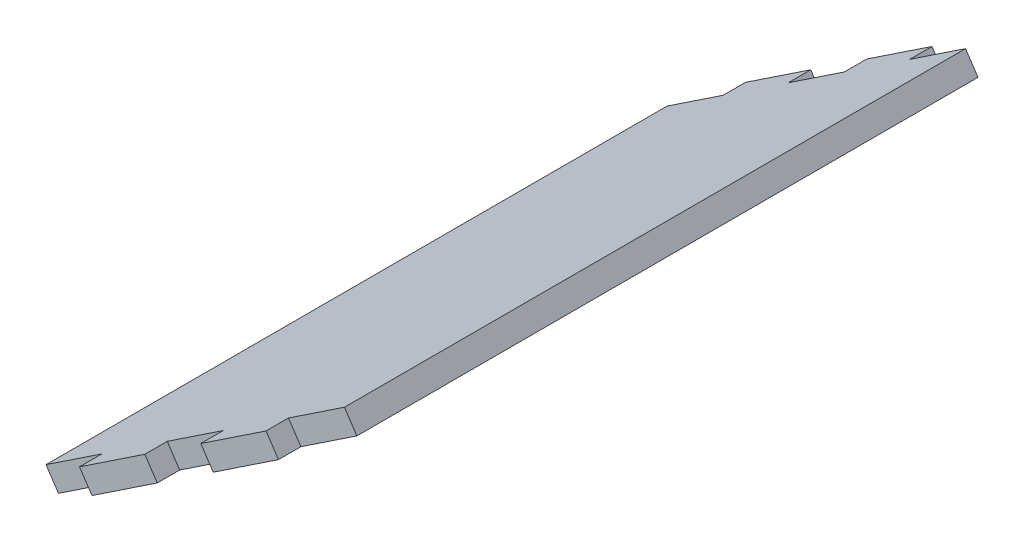
from build123d import *

# Parameters (mm, degrees)
BOSS_EXTRUDE1_DEPTH = 94.322511
SKETCH2_W           = 9.525
SKETCH2_H           = 3.175
CUT_EXTRUDE1_DEPTH  = 203.831953457


with BuildPart() as part:
    # Sketch1 → Boss-Extrude1 (new body)
    with BuildSketch(Plane.XY):
        Polygon((-277.157994575, 94.685208843), (-275.396821452, 92.043449159), (-233.1286665, 120.222219127), (-234.889839623, 122.863978811), align=None)
    extrude(amount=-BOSS_EXTRUDE1_DEPTH)

    # Sketch2 → Cut-Extrude1 (cut, through all)
    with BuildSketch(Plane(origin=(-128.980248566, 193.470372849, 0), x_dir=(0.8320502943381458, 0.5547001962247761, 0), z_dir=(-0.5547001962247761, 0.8320502943381458, 0))):
        with Locations((-173.32498704, 92.735011379)):
            Rectangle(SKETCH2_W, SKETCH2_H)
        with Locations((-132.04998704, 92.735011379)):
            Rectangle(SKETCH2_W, SKETCH2_H)
        with Locations((-152.68748704, 92.735011379)):
            Rectangle(SKETCH2_W, SKETCH2_H)
        with Locations((-173.32498704, 1.5875)):
            Rectangle(SKETCH2_W, SKETCH2_H)
        with Locations((-132.04998704, 1.5875)):
            Rectangle(SKETCH2_W, SKETCH2_H)
        with Locations((-152.68748704, 1.5875)):
            Rectangle(SKETCH2_W, SKETCH2_H)
    extrude(amount=-CUT_EXTRUDE1_DEPTH, mode=Mode.SUBTRACT)


solid = part.part
